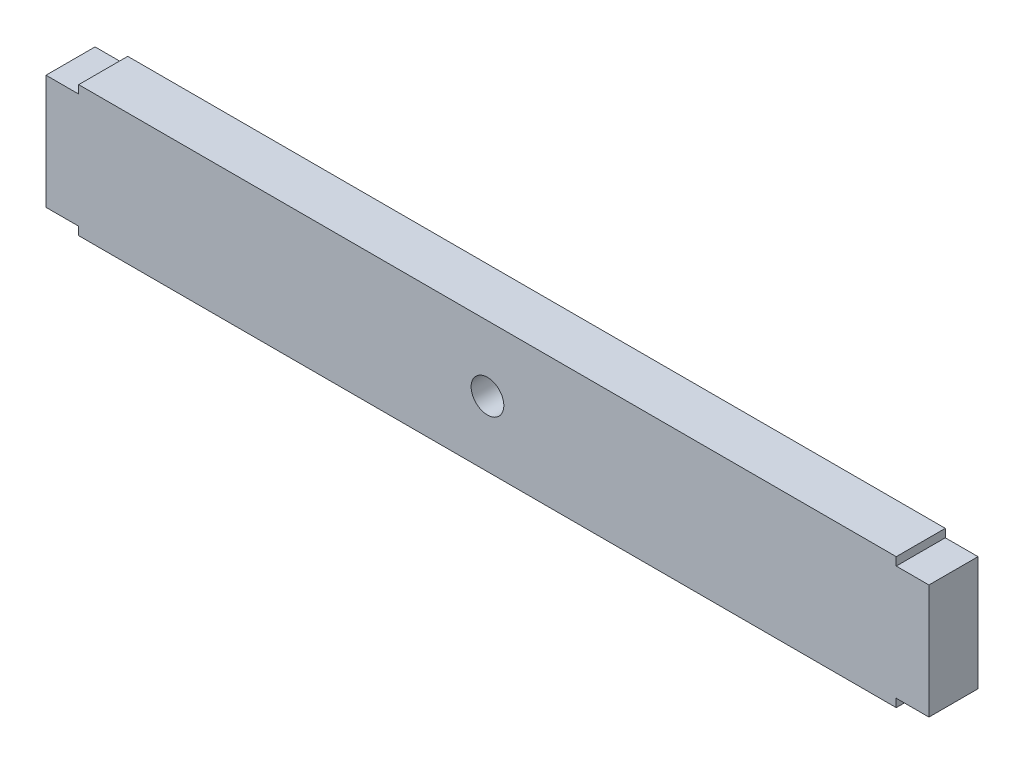
from build123d import *

# Parameters (mm, degrees)
SKETCH_1_W      = 500
SKETCH_1_H      = 80
SKETCH_1_R      = 10
SKETCH_1_W_2    = 20
SKETCH_1_H_2    = 70
EXTRUDE_1_DEPTH = 30


with BuildPart() as part:
    # 草图1 → 凸台-拉伸1 (new body)
    # profile 1 of 3: a face of its own
    with BuildSketch(Plane.XY):
        Rectangle(SKETCH_1_W, SKETCH_1_H)
        Circle(SKETCH_1_R, mode=Mode.SUBTRACT)
    # profile 2 of 3: a face of its own
    with BuildSketch(Plane.XY):
        with Locations((-260, 0)):
            Rectangle(SKETCH_1_W_2, SKETCH_1_H_2)
    # profile 3 of 3: a face of its own
    with BuildSketch(Plane.XY):
        with Locations((260, 0)):
            Rectangle(SKETCH_1_W_2, SKETCH_1_H_2)
    extrude(amount=EXTRUDE_1_DEPTH)


solid = part.part
